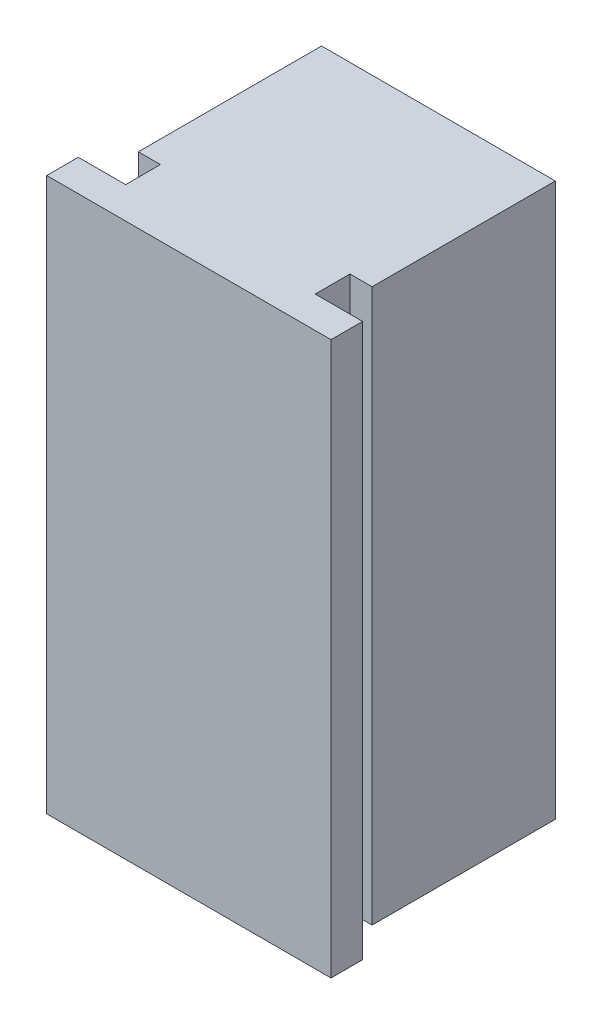
from build123d import *

# Parameters (mm, degrees)
SKETCH1_W           = 6
SKETCH1_H           = 2.2
BOSS_EXTRUDE1_DEPTH = 35
SKETCH2_R           = 4.5
CUT_EXTRUDE1_DEPTH  = 12


with BuildPart() as part:
    # Sketch1 → Boss-Extrude1 (new body)
    with BuildSketch(Plane(origin=(0, 0, 0), x_dir=(1, 0, 0), z_dir=(0, 1, 0))):
        Polygon((1.535483871, -3.361290323), (1.535483871, -14.961290323), (2.935483871, -14.961290323), (8.935483871, -14.961290323), (8.935483871, -3.361290323), align=None)
        Polygon((16.335483871, -3.361290323), (8.935483871, -3.361290323), (8.935483871, -14.961290323), (14.935483871, -14.961290323), (16.335483871, -14.961290323), align=None)
        with Locations((11.935483871, -16.061290323)):
            Rectangle(SKETCH1_W, SKETCH1_H)
        with Locations((5.935483871, -16.061290323)):
            Rectangle(SKETCH1_W, SKETCH1_H)
        Polygon((8.935483871, -17.161290323), (2.935483871, -17.161290323), (-0.064516129, -17.161290323), (-0.064516129, -19.161290323), (8.935483871, -19.161290323), align=None)
        Polygon((14.935483871, -17.161290323), (8.935483871, -17.161290323), (8.935483871, -19.161290323), (17.935483871, -19.161290323), (17.935483871, -17.161290323), align=None)
    extrude(amount=BOSS_EXTRUDE1_DEPTH)

    # Sketch2 → Cut-Extrude1 (cut)
    with BuildSketch(Plane(origin=(0, 0, 3.361290323), x_dir=(-1, 0, 0), z_dir=(0, 0, -1))):
        with Locations((-8.935483871, 17.5)):
            Circle(SKETCH2_R)
    extrude(amount=-CUT_EXTRUDE1_DEPTH, mode=Mode.SUBTRACT)


solid = part.part
